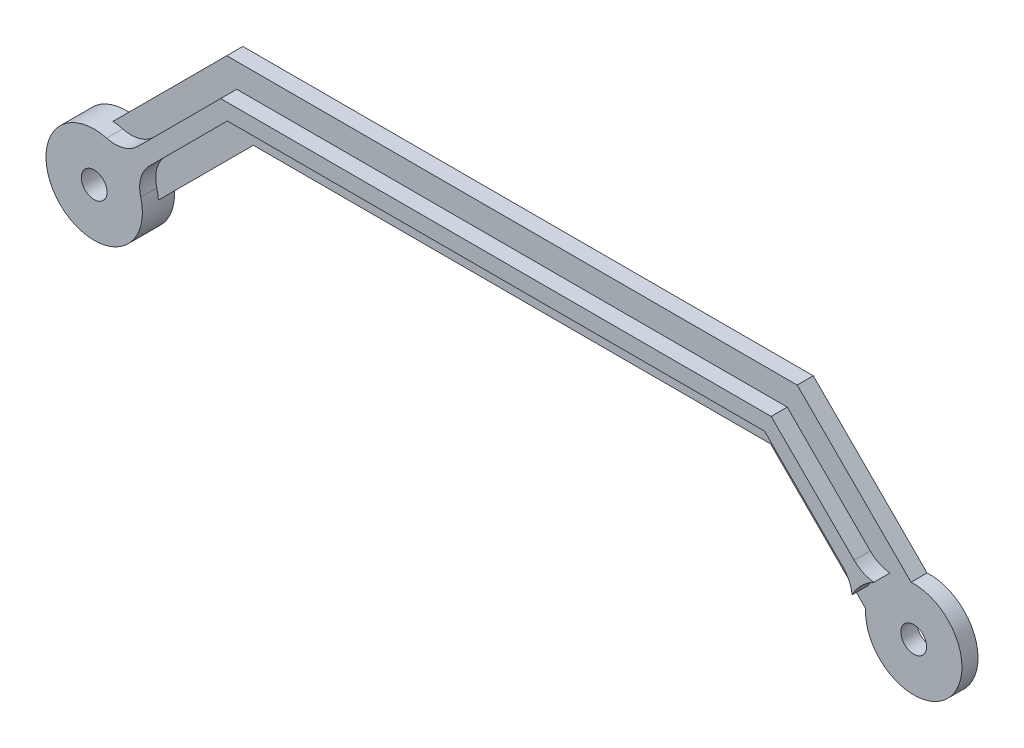
from build123d import *

# Parameters (mm, degrees)
SKETCH1_R             = 4
BOSS_EXTRUDE1_DEPTH   = 5
BOSS_EXTRUDE2_DEPTH   = 5
SKETCH7_R             = 15
SKETCH7_R_2           = 4
BOSS_EXTRUDE3_DEPTH   = 5
FILLET1_R             = 10
IZIM1_R               = 16
KES_EKSTR_ZYON1_DEPTH = 5


with BuildPart() as part:
    # Sketch1 → Boss-Extrude1 (new body)
    with BuildSketch(Plane.XY):
        with BuildLine():
            Line((44.539250231, 30.397114607), (14.976761962, 0.834626339))
            ThreePointArc((14.976761962, 0.834626339), (-10.606601718, -10.606601718), (0.834626339, 14.976761962))
            Line((0.834626339, 14.976761962), (36.254978983, 50.397114607))
            Line((36.254978983, 50.397114607), (213.745021017, 50.397114607))
            Line((213.745021017, 50.397114607), (249.165373661, 14.976761962))
            ThreePointArc((249.165373661, 14.976761962), (260.606601718, -10.606601718), (235.023238038, 0.834626339))
            Line((235.023238038, 0.834626339), (205.460749769, 30.397114607))
            Line((205.460749769, 30.397114607), (44.539250231, 30.397114607))
        make_face()
        Circle(SKETCH1_R, mode=Mode.SUBTRACT)
        with Locations((250, 0)):
            Circle(SKETCH1_R, mode=Mode.SUBTRACT)
    extrude(amount=BOSS_EXTRUDE1_DEPTH)

    # Sketch6 → Boss-Extrude2 (add)
    with BuildSketch(Plane.XY.offset(5)):
        Polygon((243.862072803, 9.673461103), (210.638419299, 42.897114607), (39.361580701, 42.897114607), (6.137927197, 9.673461103), (9.673461103, 6.137927197), (41.432648513, 37.897114607), (208.567351487, 37.897114607), (240.326538897, 6.137927197), align=None)
    extrude(amount=BOSS_EXTRUDE2_DEPTH)

    # Sketch7 → Boss-Extrude3 (add)
    # profile 1 of 2: a face of its own
    with BuildSketch(Plane.XY.offset(5)):
        Circle(SKETCH7_R)
        Circle(SKETCH7_R_2, mode=Mode.SUBTRACT)
    # profile 2 of 2: a face of its own
    with BuildSketch(Plane.XY.offset(5)):
        with Locations((250, 0)):
            Circle(SKETCH7_R)
        with Locations((250, 0)):
            Circle(SKETCH7_R_2, mode=Mode.SUBTRACT)
    extrude(amount=BOSS_EXTRUDE3_DEPTH)

    # Fillet1
    fillet1_edges = [part.edges().sort_by_distance(p)[0] for p in [
        (8.690483379, 12.226017285, 7.5),
        (12.226017285, 8.690483379, 7.5),
        (241.309516621, 12.226017285, 7.5),
        (237.773982715, 8.690483379, 7.5),
    ]]
    fillet(fillet1_edges, radius=FILLET1_R)

    # Çizim1 → Kes-Ekstrüzyon1 (cut)
    with BuildSketch(Plane.XY.offset(10)):
        with Locations((250, 0)):
            Circle(IZIM1_R)
    extrude(amount=-KES_EKSTR_ZYON1_DEPTH, mode=Mode.SUBTRACT)


solid = part.part
